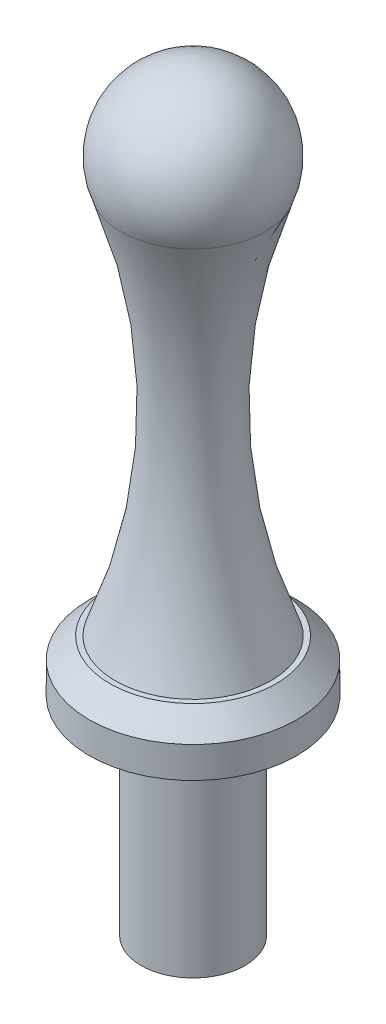
from build123d import *

# Parameters (mm, degrees)
SKETCH1_W     = 3.175
SKETCH1_H     = 12.7
CHAMFER1_SIZE = 1.27


with BuildPart() as part:
    # Sketch1 → Revolve1 (revolve)
    with BuildSketch(Plane.XY, mode=Mode.PRIVATE) as revolve1_sk:
        with BuildLine():
            ThreePointArc((-3.367596045, 31.557403955), (-1.822529847, 30.525023726), (0, 30.1625))
            Line((0, 30.1625), (0, 39.6875))
            ThreePointArc((0, 39.6875), (-3.367596045, 38.292596045), (-4.7625, 34.925))
            ThreePointArc((-4.7625, 34.925), (-4.670989898, 33.995882341), (-4.399976274, 33.102470153))
            ThreePointArc((-4.399976274, 33.102470153), (-3.959874029, 32.279096765), (-3.367596045, 31.557403955))
        make_face()
        with BuildLine():
            Line((-4.7625, 9.525), (0, 9.525))
            Line((0, 9.525), (0, 30.1625))
            ThreePointArc((0, 30.1625), (-1.822529847, 30.525023726), (-3.367596045, 31.557403955))
            ThreePointArc((-3.367596045, 31.557403955), (-3.959874029, 32.279096765), (-4.399976274, 33.102470153))
            ThreePointArc((-4.399976274, 33.102470153), (-2.411195624, 21.280368821), (-4.7625, 9.525))
        make_face()
        Polygon((-6.35, 6.35), (-3.175, 6.35), (0, 6.35), (0, 9.525), (-4.7625, 9.525), (-6.35, 9.525), align=None)
        with Locations((-1.5875, 0)):
            Rectangle(SKETCH1_W, SKETCH1_H)
    revolve(revolve1_sk.sketch.rotate(Axis((0, 45.924305238, 0), (0, 1, 0)), 180), axis=Axis((0, 45.924305238, 0), (0, 1, 0)))

    # Chamfer1
    chamfer1_edges = [part.edges().sort_by_distance(p)[0] for p in [
        (-6.35, 9.525, 0),
    ]]
    chamfer(chamfer1_edges, length=CHAMFER1_SIZE)


solid = part.part
